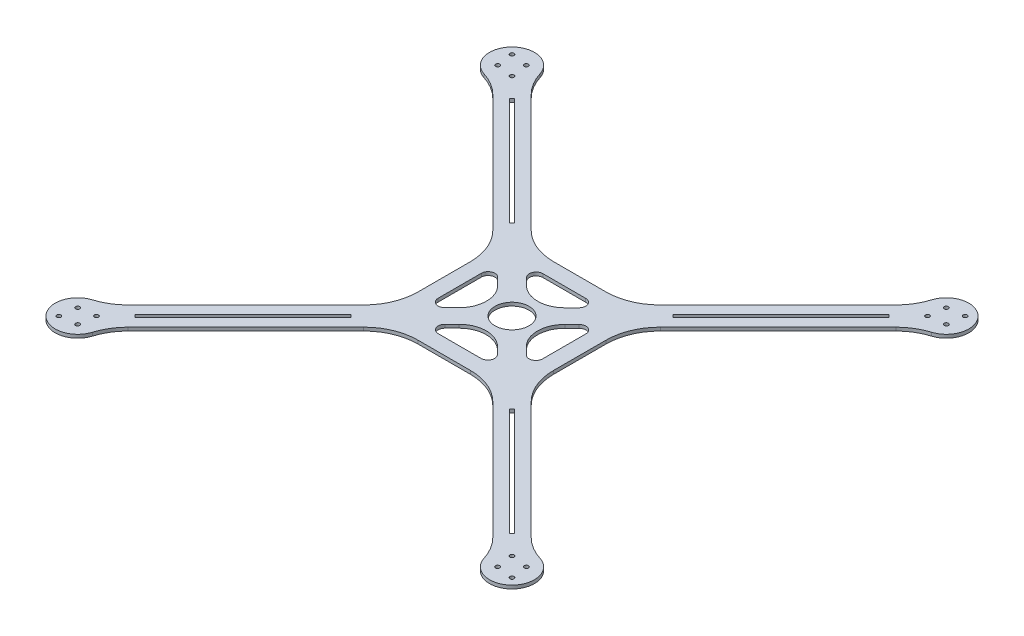
from build123d import *

# Parameters (mm, degrees)
BOSS_EXTRUDE1_DEPTH     = 3.175
SKETCH4_R               = 1.905
CUT_EXTRUDE1_DEPTH      = 318.018940562
CIRPATTERN1_COUNT       = 4
CUT_EXTRUDE2_DEPTH      = 318.018940562
CUT_EXTRUDE4_DEPTH      = 318.018940562
CUT_EXTRUDE5_DEPTH      = 318.018940562
CUT_EXTRUDE5_DEPTH_BACK = 318.018940562
SKETCH9_R               = 15.875
CIRPATTERN2_COUNT       = 4


with BuildPart() as part:
    # Sketch3 → Boss-Extrude1 (new body)
    with BuildSketch(Plane(origin=(0, 0, 0), x_dir=(1, 0, 0), z_dir=(0, 1, 0))):
        with BuildLine():
            Line((-24.497438789, -63.5), (24.497438789, -63.5))
            ThreePointArc((24.497438789, -63.5), (43.937757153, -67.366919748), (60.418463274, -78.378975516))
            Line((60.418463274, -78.378975516), (170.592111486, -188.552623728))
            ThreePointArc((170.592111486, -188.552623728), (178.158900465, -198.21626677), (183.187131602, -209.412658327))
            ThreePointArc((183.187131602, -209.412658327), (218.0174226, -218.0174226), (209.412658327, -183.187131602))
            ThreePointArc((209.412658327, -183.187131602), (198.21626677, -178.158900465), (188.552623728, -170.592111486))
            Line((188.552623728, -170.592111486), (78.378975516, -60.418463274))
            ThreePointArc((78.378975516, -60.418463274), (67.366919748, -43.937757153), (63.5, -24.497438789))
            Line((63.5, -24.497438789), (63.5, 24.497438789))
            ThreePointArc((63.5, 24.497438789), (67.366919748, 43.937757153), (78.378975516, 60.418463274))
            Line((78.378975516, 60.418463274), (188.552623728, 170.592111486))
            ThreePointArc((188.552623728, 170.592111486), (198.21626677, 178.158900465), (209.412658327, 183.187131602))
            ThreePointArc((209.412658327, 183.187131602), (218.0174226, 218.0174226), (183.187131602, 209.412658327))
            ThreePointArc((183.187131602, 209.412658327), (178.158900465, 198.21626677), (170.592111486, 188.552623728))
            Line((170.592111486, 188.552623728), (60.418463274, 78.378975516))
            ThreePointArc((60.418463274, 78.378975516), (43.937757153, 67.366919748), (24.497438789, 63.5))
            Line((24.497438789, 63.5), (-24.497438789, 63.5))
            ThreePointArc((-24.497438789, 63.5), (-43.937757153, 67.366919748), (-60.418463274, 78.378975516))
            Line((-60.418463274, 78.378975516), (-170.592111486, 188.552623728))
            ThreePointArc((-170.592111486, 188.552623728), (-178.158900465, 198.21626677), (-183.187131602, 209.412658327))
            ThreePointArc((-183.187131602, 209.412658327), (-218.0174226, 218.0174226), (-209.412658327, 183.187131602))
            ThreePointArc((-209.412658327, 183.187131602), (-198.21626677, 178.158900465), (-188.552623728, 170.592111486))
            Line((-188.552623728, 170.592111486), (-78.378975516, 60.418463274))
            ThreePointArc((-78.378975516, 60.418463274), (-67.366919748, 43.937757153), (-63.5, 24.497438789))
            Line((-63.5, 24.497438789), (-63.5, -24.497438789))
            ThreePointArc((-63.5, -24.497438789), (-67.366919748, -43.937757153), (-78.378975516, -60.418463274))
            Line((-78.378975516, -60.418463274), (-188.552623728, -170.592111486))
            ThreePointArc((-188.552623728, -170.592111486), (-198.21626677, -178.158900465), (-209.412658327, -183.187131602))
            ThreePointArc((-209.412658327, -183.187131602), (-218.0174226, -218.0174226), (-183.187131602, -209.412658327))
            ThreePointArc((-183.187131602, -209.412658327), (-178.158900465, -198.21626677), (-170.592111486, -188.552623728))
            Line((-170.592111486, -188.552623728), (-60.418463274, -78.378975516))
            ThreePointArc((-60.418463274, -78.378975516), (-43.937757153, -67.366919748), (-24.497438789, -63.5))
        make_face()
    extrude(amount=BOSS_EXTRUDE1_DEPTH)

    # Sketch4 → Cut-Extrude1 (cut, through all)
    with BuildSketch(Plane(origin=(0, 3.175, 0), x_dir=(1, 0, 0), z_dir=(0, 1, 0))):
        with Locations((194.399349001, 194.399349001)):
            Circle(SKETCH4_R)
        with Locations((209.935192091, 196.464807909)):
            Circle(SKETCH4_R)
        with Locations((212.000650999, 212.000650999)):
            Circle(SKETCH4_R)
        with Locations((196.464807909, 209.935192091)):
            Circle(SKETCH4_R)
    cut_extrude1 = extrude(amount=-CUT_EXTRUDE1_DEPTH, mode=Mode.SUBTRACT)

    # CirPattern1: Cut-Extrude1 ×4 about axis
    cirpattern1_axis = Axis((0, 5.000625, 0), (0, -1, 0))
    for i in range(1, CIRPATTERN1_COUNT):
        add(cut_extrude1.rotate(cirpattern1_axis, i * 360 / CIRPATTERN1_COUNT), mode=Mode.SUBTRACT)

    # Sketch5 → Cut-Extrude2 (cut, through all)
    with BuildSketch(Plane(origin=(0, 3.175, 0), x_dir=(1, 0, 0), z_dir=(0, 1, 0))):
        Polygon((74.212074237, 76.63674339), (175.04689706, 177.471566213), (177.471566213, 175.04689706), (76.63674339, 74.212074237), align=None)
    cut_extrude2 = extrude(amount=-CUT_EXTRUDE2_DEPTH, mode=Mode.SUBTRACT)

    # Sketch8 → Cut-Extrude4 (cut, through all)
    with BuildSketch(Plane(origin=(0, 3.175, 0), x_dir=(1, 0, 0), z_dir=(0, 1, 0))):
        with BuildLine():
            Line((-38.184603855, -24.584989879), (-31.467798631, -17.895778814))
            ThreePointArc((-31.467798631, -17.895778814), (-23.991357843, 0.049382407), (-31.393861052, 18.025169576))
            Line((-31.393861052, 18.025169576), (-38.16611946, 24.825364729))
            ThreePointArc((-38.16611946, 24.825364729), (-45.089480956, 26.213621224), (-49.015480206, 20.344488378))
            Line((-49.015480206, 20.344488378), (-49.015480206, -20.085629132))
            ThreePointArc((-49.015480206, -20.085629132), (-45.101556475, -25.949760135), (-38.184603855, -24.584989879))
        make_face()
        with BuildLine():
            Line((-20.142290993, -48.814113494), (19.88508968, -48.814113494))
            ThreePointArc((19.88508968, -48.814113494), (25.749220683, -44.900189762), (24.384450426, -37.983237143))
            Line((24.384450426, -37.983237143), (17.895778814, -31.467798631))
            ThreePointArc((17.895778814, -31.467798631), (-0.049382407, -23.991357843), (-18.025169576, -31.393861052))
            Line((-18.025169576, -31.393861052), (-24.623167344, -37.964752748))
            ThreePointArc((-24.623167344, -37.964752748), (-26.011423839, -44.888114243), (-20.142290993, -48.814113494))
        make_face()
        with BuildLine():
            Line((-19.88508968, 48.814113494), (20.142290993, 48.814113494))
            ThreePointArc((20.142290993, 48.814113494), (26.011423839, 44.888114243), (24.623167344, 37.964752748))
            Line((24.623167344, 37.964752748), (18.025169576, 31.393861052))
            ThreePointArc((18.025169576, 31.393861052), (0.049382407, 23.991357843), (-17.895778814, 31.467798631))
            Line((-17.895778814, 31.467798631), (-24.384450426, 37.983237143))
            ThreePointArc((-24.384450426, 37.983237143), (-25.749220683, 44.900189762), (-19.88508968, 48.814113494))
        make_face()
        with BuildLine():
            Line((49.015480206, -20.344488378), (49.015480206, 20.085629132))
            ThreePointArc((49.015480206, 20.085629132), (45.101556475, 25.949760135), (38.184603855, 24.584989879))
            Line((38.184603855, 24.584989879), (31.467798631, 17.895778814))
            ThreePointArc((31.467798631, 17.895778814), (23.991357843, -0.049382407), (31.393861052, -18.025169576))
            Line((31.393861052, -18.025169576), (38.16611946, -24.825364729))
            ThreePointArc((38.16611946, -24.825364729), (45.089480956, -26.213621224), (49.015480206, -20.344488378))
        make_face()
    extrude(amount=-CUT_EXTRUDE4_DEPTH, mode=Mode.SUBTRACT)

    # Sketch9 → Cut-Extrude5 (cut, two sides: drawn at the far end of the back side and taken through both)
    with BuildSketch(Plane(origin=(0, 3.175, 0), x_dir=(1, 0, 0), z_dir=(0, 1, 0)).offset(-CUT_EXTRUDE5_DEPTH_BACK)):
        Circle(SKETCH9_R)
    extrude(amount=CUT_EXTRUDE5_DEPTH + CUT_EXTRUDE5_DEPTH_BACK, mode=Mode.SUBTRACT)

    # CirPattern2: Cut-Extrude2 ×4 about axis
    cirpattern2_axis = Axis((0, 5.000625, 0), (0, -1, 0))
    for i in range(1, CIRPATTERN2_COUNT):
        add(cut_extrude2.rotate(cirpattern2_axis, i * 360 / CIRPATTERN2_COUNT), mode=Mode.SUBTRACT)


solid = part.part
